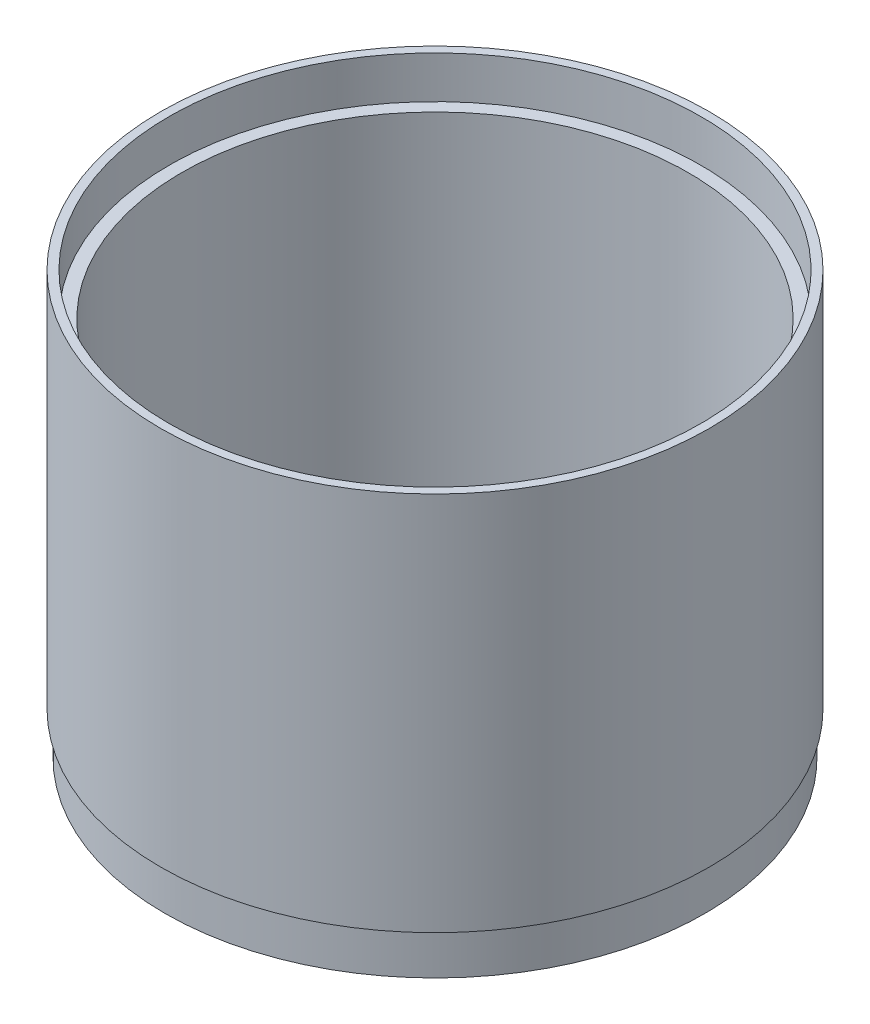
from build123d import *


with BuildPart() as part:
    # Szkic1 → Obrót1 (revolve)
    with BuildSketch(Plane.XY, mode=Mode.PRIVATE) as obr_t1_sk:
        Polygon((-64, 10), (-64, 0), (-60, 0), (-60, 90), (-63, 90), (-63, 100), (-65, 100), (-65, 28.561789866), (-65, 10), align=None)
    revolve(obr_t1_sk.sketch.rotate(Axis((0, 35.541039942, 0), (0, -1, 0)), 270), axis=Axis((0, 35.541039942, 0), (0, -1, 0)))


solid = part.part
